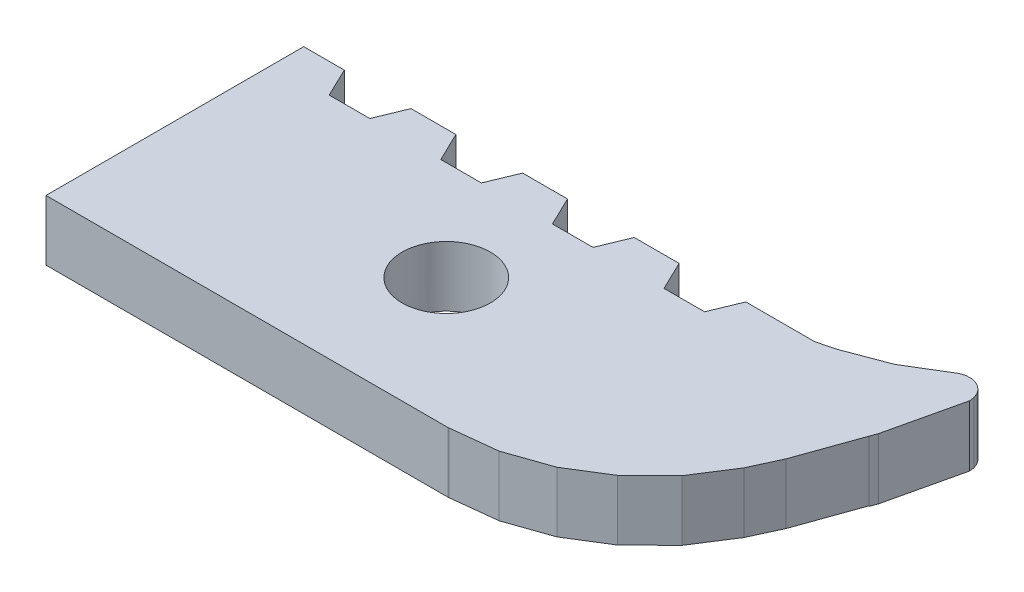
from build123d import *

# Parameters (mm, degrees)
BOSS_EXTRUDE1_DEPTH = 2.975
SKETCH3_R           = 2.175
CUT_EXTRUDE1_DEPTH  = 10
BOSS_EXTRUDE2_DEPTH = 3
CUT_EXTRUDE4_DEPTH  = 3
CUT_EXTRUDE5_DEPTH  = 3
CUT_EXTRUDE6_DEPTH  = 3
CUT_EXTRUDE7_DEPTH  = 3


with BuildPart() as part:
    # Sketch1 → Boss-Extrude1 (new body)
    with BuildSketch(Plane(origin=(0, 0, 0), x_dir=(1, 0, 0), z_dir=(0, 1, 0))):
        with BuildLine():
            Line((-23.171929825, 5.625877193), (-23.171929825, -7.074122807))
            Line((-23.171929825, -7.074122807), (2.228070175, -7.074122807))
            ThreePointArc((2.228070175, -7.074122807), (8.578070175, -0.724122807), (2.228070175, 5.625877193))
            Line((2.228070175, 5.625877193), (-23.171929825, 5.625877193))
        make_face()
    extrude(amount=BOSS_EXTRUDE1_DEPTH)

    # Sketch3 → Cut-Extrude1 (cut)
    with BuildSketch(Plane(origin=(0, 2.975, 0), x_dir=(1, 0, 0), z_dir=(0, 1, 0))):
        Polygon((-17.882133224, 5.625877193), (-21.171929825, 5.625877193), (-20.476894991, 4.187255521), (-18.476894991, 4.187255521), align=None)
        Polygon((-12.382133224, 5.625877193), (-15.671929825, 5.625877193), (-14.976894991, 4.187255521), (-12.976894991, 4.187255521), align=None)
        Polygon((-6.882133224, 5.625877193), (-10.171929825, 5.625877193), (-9.476894991, 4.187255521), (-7.476894991, 4.187255521), align=None)
        Polygon((-1.382133224, 5.625877193), (-4.671929825, 5.625877193), (-3.976894991, 4.187255521), (-1.976894991, 4.187255521), align=None)
        with Locations(Location((-9.806894991, -0.713854538, 0), (0, 0, 270))):
            Circle(SKETCH3_R)
    extrude(amount=-CUT_EXTRUDE1_DEPTH, mode=Mode.SUBTRACT)

    # Sketch4 → Boss-Extrude2 (add)
    with BuildSketch(Plane(origin=(0, 2.975, 0), x_dir=(1, 0, 0), z_dir=(0, 1, 0))):
        Polygon((2.012508497, 5.625877193), (2.877447204, 5.848143738), (4.955403332, 6.631142622), (6.932313313, 7.831153974), (7.181023471, 7.907898717), (7.449388225, 7.917059752), (7.669017249, 7.869526346), (7.909998428, 7.749936115), (8.090301913, 7.593296768), (8.229089145, 7.396943716), (8.320584378, 7.15885929), (8.349013293, 6.921336926), (7.506024116, 3.278478183), (7.381859278, 2.936726049), (7.191829205, 3.236129243), (6.188322225, 4.239636223), (4.955403332, 5.010347862), (3.635222185, 5.468003098), align=None)
    extrude(amount=-BOSS_EXTRUDE2_DEPTH)

    # Sketch5 → Cut-Extrude4 (cut)
    with BuildSketch(Plane.XZ):
        Polygon((7.381859278, -2.936726049), (6.307567975, 0.076195893), (5.651690171, 1.50143626), (4.463765556, 3.356436211), (2.862913669, 4.934447261), (1.01921029, 6.082107474), (-1.092761509, 6.819455434), (-3.321732513, 7.068870042), (2.228070175, 7.074122807), (3.760260473, 6.886500018), (5.204465919, 6.333362361), (6.48158413, 5.439005525), (7.484091138, 4.287371835), (8.1884819, 2.914098165), (8.543501486, 1.385808052), (8.521355854, -0.122668414), (8.123713387, -1.634667375), (7.393611108, -2.969071864), align=None)
    extrude(amount=-CUT_EXTRUDE4_DEPTH, mode=Mode.SUBTRACT)

    # Sketch8 → Cut-Extrude5 (cut)
    with BuildSketch(Plane.XZ):
        Polygon((7.393611108, -2.969071864), (4.817266947, 7.178326075), (13.149056149, 1.259568719), align=None)
    extrude(amount=-CUT_EXTRUDE5_DEPTH, mode=Mode.SUBTRACT)

    # Sketch9 → Cut-Extrude6 (cut)
    with BuildSketch(Plane(origin=(0, 2.975, 0), x_dir=(1, 0, 0), z_dir=(0, 1, 0))):
        Polygon((-2.812690859, -7.210619116), (5.027177804, -8.631982179), (5.504181298, -6.000955074), align=None)
    extrude(amount=-CUT_EXTRUDE6_DEPTH, mode=Mode.SUBTRACT)

    # Sketch10 → Cut-Extrude7 (cut)
    with BuildSketch(Plane(origin=(0, 2.975, 0), x_dir=(1, 0, 0), z_dir=(0, 1, 0))):
        Polygon((-3.321732513, -7.068870042), (-3.353757598, -7.074122807), (-1.90048619, -7.144223144), (-1.755238834, -7.012343357), align=None)
    extrude(amount=-CUT_EXTRUDE7_DEPTH, mode=Mode.SUBTRACT)


solid = part.part
